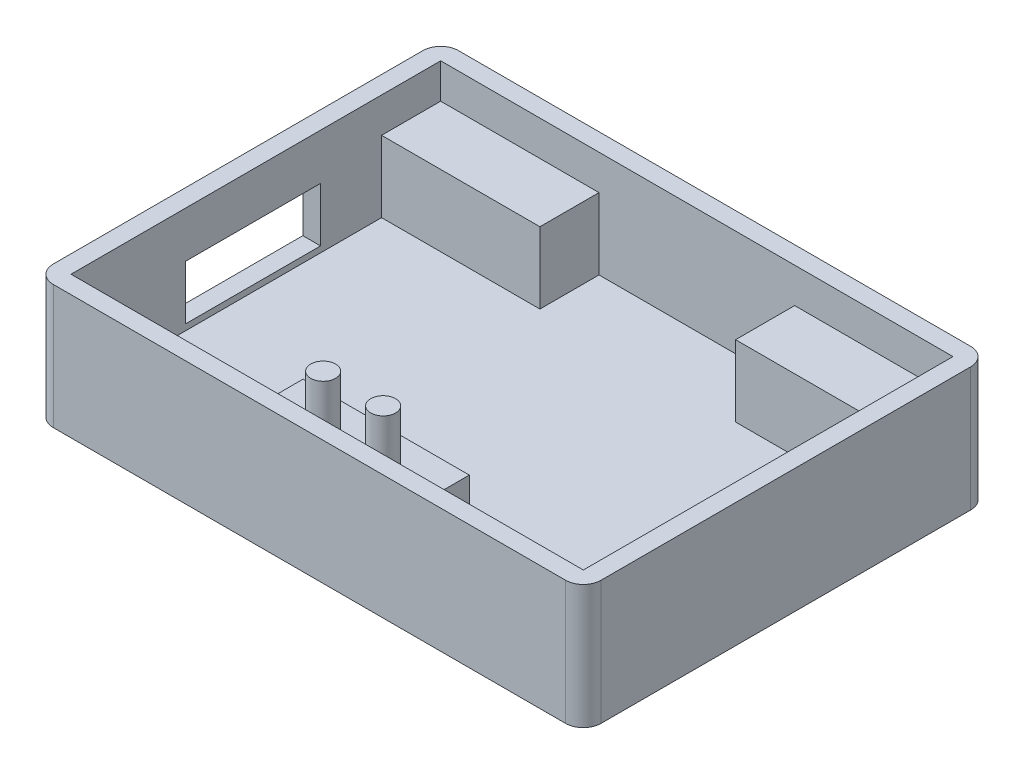
from build123d import *

# Parameters (mm, degrees)
BOSS_EXTRUDE5_DEPTH   = 2.54
SKETCH1_14_W          = 78.53
SKETCH1_14_H          = 58.08
SKETCH1_14_W_2        = 73.45
SKETCH1_14_H_2        = 53
BOSS_EXTRUDE6_DEPTH   = 17.78
SKETCH1_15_R          = 1.778
BOSS_EXTRUDE7_DEPTH   = 20.32
BOSS_EXTRUDE7_2_DEPTH = 20.32
SKETCH1_16_W          = 22.699017595
SKETCH1_16_H          = 8.472740405
SKETCH1_16_W_2        = 23.825224437
SKETCH1_16_H_2        = 8.631081672
SKETCH1_16_R          = 1.778
BOSS_EXTRUDE8_DEPTH   = 12.7635
SKETCH2_W             = 19.346850656
SKETCH2_H             = 7.764196645
CUT_EXTRUDE1_DEPTH    = 2.54
FILLET1_R             = 2.54


with BuildPart() as part:
    # Sketch1 → Boss-Extrude5 (new body)
    with BuildSketch(Plane(origin=(0, 0, 0), x_dir=(1, 0, 0), z_dir=(0, 1, 0))):
        Polygon((13.927874743, 17.78199044), (13.927874743, 26.254730845), (-14.124090067, 26.254730845), (-14.124090067, 17.78199044), (-36.823107662, 17.78199044), (-36.823107662, -26.745269155), (-12.176172828, -26.745269155), (-12.176172828, -18.114187483), (11.649051609, -18.114187483), (11.649051609, -26.745269155), (36.626892338, -26.745269155), (36.626892338, 17.78199044), align=None)
    extrude(amount=BOSS_EXTRUDE5_DEPTH)

    # Sketch1<14> → Boss-Extrude6 (add)
    with BuildSketch(Plane(origin=(0, 0, 0), x_dir=(1, 0, 0), z_dir=(0, 1, 0))):
        with Locations((-0.098107662, -0.245269155)):
            Rectangle(SKETCH1_14_W, SKETCH1_14_H)
        with Locations((-0.098107662, -0.245269155)):
            Rectangle(SKETCH1_14_W_2, SKETCH1_14_H_2, mode=Mode.SUBTRACT)
    extrude(amount=BOSS_EXTRUDE6_DEPTH)



with BuildPart() as body_2:
    # Sketch1<15> → Boss-Extrude7 (new body)
    with BuildSketch(Plane(origin=(0, 0, 0), x_dir=(1, 0, 0), z_dir=(0, 1, 0))):
        with Locations(Location((-4.171215324, -23.247161493, 0), (0, 0, 270))):
            Circle(SKETCH1_15_R)
    extrude(amount=BOSS_EXTRUDE7_DEPTH)


with BuildPart() as body_3:
    # Sketch1<15> → Boss-Extrude7 2 (new body)
    with BuildSketch(Plane(origin=(0, 0, 0), x_dir=(1, 0, 0), z_dir=(0, 1, 0))):
        with Locations(Location((4.428784676, -23.247161493, 0), (0, 0, 270))):
            Circle(SKETCH1_15_R)
    extrude(amount=BOSS_EXTRUDE7_2_DEPTH)


with BuildPart() as part_1:
    add(part.part)

    add(body_2.part)  # Boss-Extrude8 merges body 2

    add(body_3.part)  # Boss-Extrude8 merges body 3
    # Sketch1<16> → Boss-Extrude8 (add)
    # profile 1 of 3: a face of its own
    with BuildSketch(Plane(origin=(0, 0, 0), x_dir=(1, 0, 0), z_dir=(0, 1, 0))):
        with Locations((25.277383541, 22.018360642)):
            Rectangle(SKETCH1_16_W, SKETCH1_16_H)
    # profile 2 of 3: a face of its own
    with BuildSketch(Plane(origin=(0, 0, 0), x_dir=(1, 0, 0), z_dir=(0, 1, 0))):
        with Locations((-25.473598865, 22.018360642)):
            Rectangle(SKETCH1_16_W, SKETCH1_16_H)
    # profile 3 of 3: a face of its own
    with BuildSketch(Plane(origin=(0, 0, 0), x_dir=(1, 0, 0), z_dir=(0, 1, 0))):
        with Locations((-0.263560609, -22.429728319)):
            Rectangle(SKETCH1_16_W_2, SKETCH1_16_H_2)
        with Locations((-4.171215324, -23.247161493)):
            Circle(SKETCH1_16_R, mode=Mode.SUBTRACT)
        with Locations((4.428784676, -23.247161493)):
            Circle(SKETCH1_16_R, mode=Mode.SUBTRACT)
    extrude(amount=BOSS_EXTRUDE8_DEPTH)

    # Sketch2 → Cut-Extrude1 (cut)
    with BuildSketch(Plane.ZY.offset(39.363107662)):
        with Locations((0.640618985, 7.290284295)):
            Rectangle(SKETCH2_W, SKETCH2_H)
    extrude(amount=-CUT_EXTRUDE1_DEPTH, mode=Mode.SUBTRACT)

    # Fillet1
    fillet1_edges = [part_1.edges().sort_by_distance(p)[0] for p in [
        (-39.363107662, 8.89, 29.285269155),
        (39.166892338, 8.89, 29.285269155),
        (39.166892338, 8.89, -28.794730845),
        (-39.363107662, 8.89, -28.794730845),
    ]]
    fillet(fillet1_edges, radius=FILLET1_R)


solid = part_1.part
